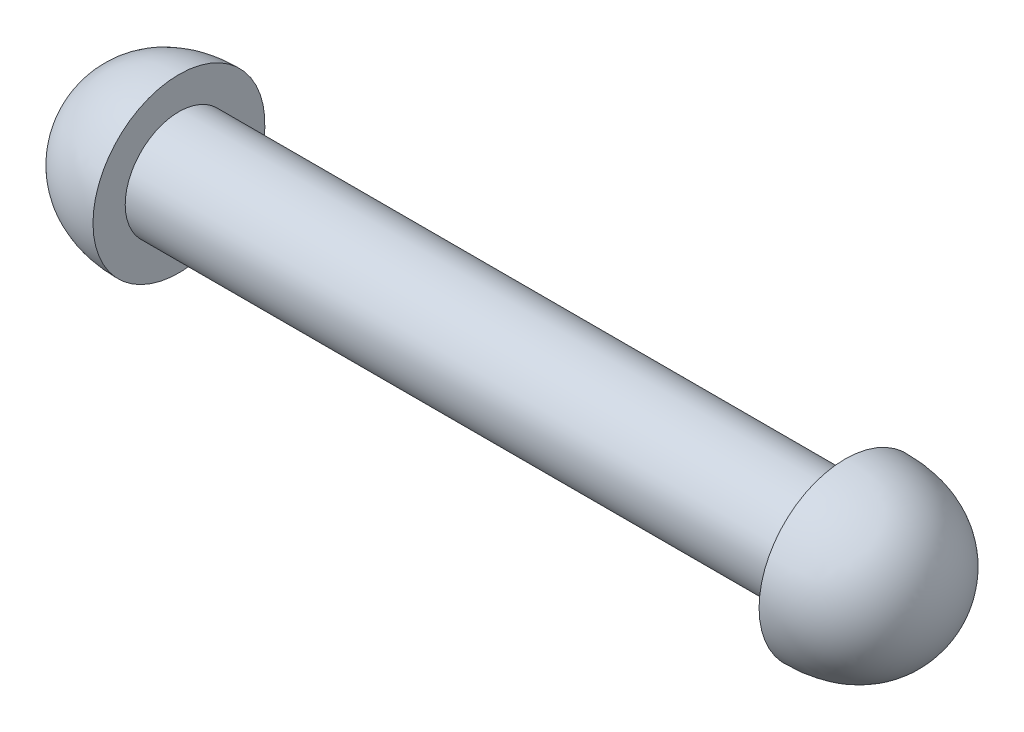
from build123d import *

# Parameters (mm, degrees)
SKETCH1_R           = 25
BOSS_EXTRUDE1_DEPTH = 155


with BuildPart() as part:
    # Sketch1 → Boss-Extrude1 (new body)
    with BuildSketch(Plane(origin=(0, 0, 0), x_dir=(0, 0, -1), z_dir=(1, 0, 0))):
        Circle(SKETCH1_R)
    boss_extrude1 = extrude(amount=BOSS_EXTRUDE1_DEPTH)

    # Sketch3 → Revolve1 (revolve)
    with BuildSketch(Plane.XY, mode=Mode.PRIVATE) as revolve1_sk:
        with BuildLine():
            Line((0, 0), (-45.458392513, 0))
            add(Edge.make_bspline(
                [(-45.458392513, 0), (-45.458392513, 20.183781855), (-30.991238831, 40), (0, 40)],
                knots=[0, 0, 0, 0, 1, 1, 1, 1], degree=3))
            Line((0, 40), (0, 0))
        make_face()
    revolve1 = revolve(revolve1_sk.sketch.rotate(Axis((-100.078673334, 0, 0), (1, 0, 0)), 90), axis=Axis((-100.078673334, 0, 0), (1, 0, 0)))

    # Mirror1: Boss-Extrude1, Revolve1 across plane
    add(boss_extrude1.mirror(Plane(origin=(155, 0, 0), x_dir=(0, 0, 1), z_dir=(1, 0, 0))))
    add(revolve1.mirror(Plane(origin=(155, 0, 0), x_dir=(0, 0, 1), z_dir=(1, 0, 0))))


solid = part.part
